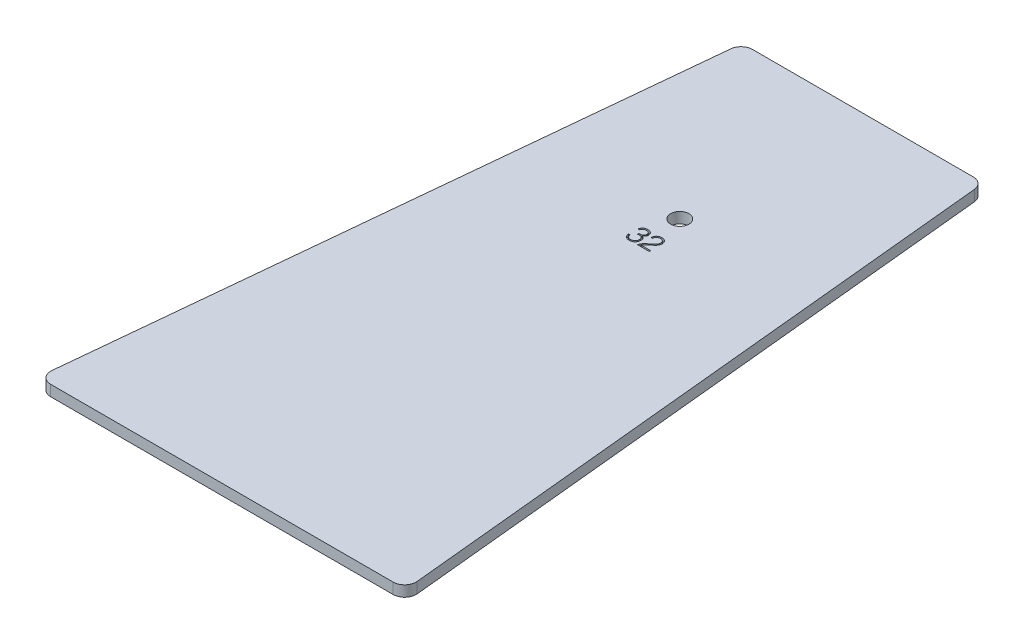
from build123d import *

# Parameters (mm, degrees)
BOSS_EXTRUDE1_DEPTH = 5.9944
SKETCH2_R           = 5.08
CUT_EXTRUDE1_DEPTH  = 370.992656505
CUT_EXTRUDE2_DEPTH  = 1.27
FILLET1_R           = 6.35


with BuildPart() as part:
    # Sketch1 → Boss-Extrude1 (new body)
    with BuildSketch(Plane(origin=(0, 0, 0), x_dir=(1, 0, 0), z_dir=(0, 1, 0))):
        Polygon((-66.9925, 0), (66.9925, 0), (102.016043034, -355.6), (-102.016043034, -355.6), align=None)
    extrude(amount=BOSS_EXTRUDE1_DEPTH)

    # Sketch2 → Cut-Extrude1 (cut, through all)
    with BuildSketch(Plane(origin=(0, 5.9944, 0), x_dir=(1, 0, 0), z_dir=(0, 1, 0))):
        with Locations(Location((0, -101.6, 0), (0, 0, 270))):
            Circle(SKETCH2_R)
    extrude(amount=-CUT_EXTRUDE1_DEPTH, mode=Mode.SUBTRACT)

    # Sketch3 → Cut-Extrude2 (cut)
    with BuildSketch(Plane(origin=(0, 5.9944, 0), x_dir=(1, 0, 0), z_dir=(0, 1, 0))):
        with BuildLine():
            Line((-7.022352941, -123.068602941), (-6.225490196, -122.940980392))
            add(Edge.make_bspline(
                [(-6.225490196, -122.940980392), (-6.179159168, -123.113672862), (-6.090766085, -123.443145791), (-5.893002314, -123.893116495), (-5.653326656, -124.277637163), (-5.362735748, -124.592717125), (-5.023623342, -124.836847536), (-4.639439373, -125.009559122), (-4.210900555, -125.114996328), (-3.91023845, -125.126417063), (-3.753970588, -125.132352941)],
                knots=[0, 0, 0, 0, 1.185952709, 2.262630877, 3.250838064, 4.182033203, 5.090336224, 6.006134824, 6.963696984, 8, 8, 8, 8], degree=3))
            add(Edge.make_bspline(
                [(-3.753970588, -125.132352941), (-3.632311974, -125.129294556), (-3.396778139, -125.123373454), (-3.055537122, -125.062438499), (-2.739613531, -124.962860022), (-2.44676451, -124.825432627), (-2.1842903, -124.650311606), (-1.946018921, -124.449446481), (-1.740349543, -124.216617453), (-1.561552955, -123.957580623), (-1.416849481, -123.67148988), (-1.319432673, -123.358844856), (-1.253270796, -123.026773567), (-1.247865406, -122.79709633), (-1.245098039, -122.679509804)],
                knots=[0, 0, 0, 0, 1.112391676, 2.1536155, 3.159607968, 4.13650094, 5.103002125, 6.039177095, 6.980681787, 7.936725385, 8.913387604, 9.901293339, 10.925537295, 12, 12, 12, 12], degree=3))
            add(Edge.make_bspline(
                [(-1.245098039, -122.679509804), (-1.246477833, -122.600522673), (-1.249194291, -122.445017372), (-1.282695151, -122.219426954), (-1.327451026, -122.004938691), (-1.396057418, -121.803943287), (-1.489048405, -121.617377102), (-1.592290807, -121.437763337), (-1.722685616, -121.275763034), (-1.917485463, -121.076343486), (-2.20188298, -120.864069311), (-2.593312238, -120.677013181), (-3.036743624, -120.571255612), (-3.346678027, -120.557536056), (-3.508063725, -120.550392157)],
                knots=[0, 0, 0, 0, 0.811772018, 1.598169866, 2.341374635, 3.06367051, 3.774921333, 4.483283491, 5.190035732, 5.907028974, 7.347870326, 8.813481259, 10.340750343, 12, 12, 12, 12], degree=3))
            add(Edge.make_bspline(
                [(-3.508063725, -120.550392157), (-3.570458136, -120.553211168), (-3.706544321, -120.55935961), (-3.923959231, -120.600132932), (-4.170366976, -120.662415604), (-4.34159116, -120.719358558), (-4.43254902, -120.749607843)],
                knots=[0, 0, 0, 0, 0.788647944, 1.720091416, 2.788864984, 4, 4, 4, 4], degree=3))
            Line((-4.43254902, -120.749607843), (-4.339166667, -119.952745098))
            add(Edge.make_bspline(
                [(-4.339166667, -119.952745098), (-4.211491436, -119.950936246), (-3.969367573, -119.947505931), (-3.628545312, -119.922817047), (-3.330265399, -119.885264194), (-3.000954361, -119.807625151), (-2.646422183, -119.674933754), (-2.338322284, -119.490885157), (-2.131152352, -119.319361376), (-1.999871604, -119.178734556), (-1.890363345, -119.027511909), (-1.797899612, -118.86789123), (-1.729210893, -118.693480512), (-1.681209143, -118.508345213), (-1.647346728, -118.311468027), (-1.644829413, -118.176557999), (-1.643529412, -118.106887255)],
                knots=[0, 0, 0, 0, 1.451240035, 2.752137916, 3.88312397, 4.8644669, 6.592895175, 8.164668079, 8.918269139, 9.644320432, 10.345018353, 11.037025267, 11.735734825, 12.468177286, 13.208930344, 14, 14, 14, 14], degree=3))
            add(Edge.make_bspline(
                [(-1.643529412, -118.106887255), (-1.650509345, -117.983610579), (-1.66411437, -117.743324277), (-1.776821399, -117.401046126), (-1.96596106, -117.098265223), (-2.224892561, -116.840701279), (-2.536214171, -116.629020004), (-2.893116827, -116.475476622), (-3.290761262, -116.383395594), (-3.568768596, -116.372523158), (-3.713504902, -116.366862745)],
                knots=[0, 0, 0, 0, 0.976737165, 1.903819668, 2.824737209, 3.785549291, 4.781400884, 5.79567262, 6.852382064, 8, 8, 8, 8], degree=3))
            add(Edge.make_bspline(
                [(-3.713504902, -116.366862745), (-3.854039415, -116.371791417), (-4.12537475, -116.381307391), (-4.513600015, -116.467110178), (-4.865095935, -116.607514109), (-5.17833718, -116.807215106), (-5.453425475, -117.062995686), (-5.684159559, -117.378756965), (-5.883219335, -117.745828774), (-5.97729652, -118.018070701), (-6.02627451, -118.159803922)],
                knots=[0, 0, 0, 0, 1.063244, 2.052845668, 2.994088376, 3.916241797, 4.850371738, 5.821675903, 6.865931876, 8, 8, 8, 8], degree=3))
            Line((-6.02627451, -118.159803922), (-6.823137255, -118.007279412))
            add(Edge.make_bspline(
                [(-6.823137255, -118.007279412), (-6.795507069, -117.908263802), (-6.741395917, -117.714350929), (-6.638235475, -117.438000328), (-6.521644051, -117.180742974), (-6.39619017, -116.940453145), (-6.251608562, -116.72101519), (-6.09249965, -116.521665128), (-5.920815848, -116.340294928), (-5.736152715, -116.176736099), (-5.535865927, -116.032888014), (-5.320569348, -115.908978205), (-5.093111316, -115.802051694), (-4.850790057, -115.717919709), (-4.594226042, -115.653756692), (-4.324277726, -115.602706227), (-4.039873378, -115.575380927), (-3.846367498, -115.571816599), (-3.747745098, -115.57)],
                knots=[0, 0, 0, 0, 1.151946065, 2.255979367, 3.302323512, 4.316963809, 5.291200695, 6.243031876, 7.172717729, 8.087440795, 9.004158252, 9.931804679, 10.868449138, 11.817504777, 12.802032331, 13.83090576, 14.894497265, 16, 16, 16, 16], degree=3))
            add(Edge.make_bspline(
                [(-3.747745098, -115.57), (-3.640762164, -115.571134578), (-3.431393848, -115.573354975), (-3.126775673, -115.609879124), (-2.837313267, -115.662151303), (-2.56322677, -115.734994388), (-2.307835885, -115.836020829), (-2.068092886, -115.955485342), (-1.843673392, -116.09447094), (-1.638127063, -116.257539882), (-1.451493202, -116.43696588), (-1.287791849, -116.633237344), (-1.153981272, -116.848271897), (-1.040592711, -117.075951667), (-0.953424076, -117.320547421), (-0.891547543, -117.580392137), (-0.853370675, -117.855698039), (-0.848936049, -118.044506384), (-0.846666667, -118.141127451)],
                knots=[0, 0, 0, 0, 1.17304118, 2.295671334, 3.360722231, 4.399095647, 5.401139445, 6.368437906, 7.334999225, 8.291519651, 9.241514563, 10.171449278, 11.087342197, 12.013926289, 12.957350552, 13.929260155, 14.940316477, 16, 16, 16, 16], degree=3))
            add(Edge.make_bspline(
                [(-0.846666667, -118.141127451), (-0.850930579, -118.256558068), (-0.859217004, -118.480884227), (-0.92146644, -118.80693692), (-1.031917246, -119.107338687), (-1.182879951, -119.386249798), (-1.379156133, -119.63939225), (-1.614751692, -119.87329668), (-1.897947491, -120.078496141), (-2.108008459, -120.192705027), (-2.21627451, -120.251568627)],
                knots=[0, 0, 0, 0, 1.039153621, 2.01947583, 2.9741737, 3.910731788, 4.863782364, 5.848192228, 6.890951849, 8, 8, 8, 8], degree=3))
            add(Edge.make_bspline(
                [(-2.21627451, -120.251568627), (-2.076605097, -120.297135403), (-1.806544353, -120.385242005), (-1.440808729, -120.58262141), (-1.133728819, -120.830069975), (-0.877589438, -121.120636681), (-0.685343201, -121.463379276), (-0.543367347, -121.847361186), (-0.463326152, -122.278848212), (-0.453422318, -122.580608394), (-0.448235294, -122.738651961)],
                knots=[0, 0, 0, 0, 1.062050142, 2.053549488, 2.988468085, 3.904211674, 4.839582746, 5.816291321, 6.856306669, 8, 8, 8, 8], degree=3))
            add(Edge.make_bspline(
                [(-0.448235294, -122.738651961), (-0.451291104, -122.855014514), (-0.457288258, -123.083380833), (-0.502478751, -123.417657966), (-0.571377301, -123.735672586), (-0.676738803, -124.034186175), (-0.807153117, -124.316876649), (-0.969873616, -124.581571508), (-1.160792719, -124.828915505), (-1.379109975, -125.056141259), (-1.620394131, -125.260207248), (-1.881430984, -125.438882746), (-2.157648032, -125.592689762), (-2.454217209, -125.713387607), (-2.766248092, -125.811407575), (-3.097158213, -125.877287666), (-3.444464768, -125.924350599), (-3.682208492, -125.927569671), (-3.80377451, -125.929215686)],
                knots=[0, 0, 0, 0, 1.072071369, 2.103984363, 3.103853144, 4.0655425, 5.015271866, 5.96812527, 6.922560812, 7.8897021, 8.866767387, 9.829597087, 10.801124953, 11.774298562, 12.775446883, 13.810677578, 14.880528982, 16, 16, 16, 16], degree=3))
            add(Edge.make_bspline(
                [(-3.80377451, -125.929215686), (-3.91174159, -125.926380954), (-4.121899618, -125.920863145), (-4.430362418, -125.890720053), (-4.721742092, -125.834404654), (-4.998637664, -125.757502141), (-5.256115535, -125.653715683), (-5.499932286, -125.53163902), (-5.726545074, -125.385760493), (-5.936578214, -125.215939691), (-6.130179855, -125.024934126), (-6.30864799, -124.813174484), (-6.467563012, -124.575955577), (-6.614344715, -124.318893999), (-6.741149501, -124.036717645), (-6.852809332, -123.733950277), (-6.950758779, -123.410032489), (-6.998114815, -123.184193544), (-7.022352941, -123.068602941)],
                knots=[0, 0, 0, 0, 1.092142754, 2.125856941, 3.130178579, 4.090157876, 5.027443808, 5.933183123, 6.844256067, 7.747255784, 8.659958934, 9.591056537, 10.542798976, 11.543715938, 12.581523217, 13.667244669, 14.806031458, 16, 16, 16, 16], degree=3))
        make_face()
        with BuildLine():
            Line((7.121960784, -125.73), (0.747058824, -125.73))
            add(Edge.make_bspline(
                [(0.747058824, -125.73), (0.773711728, -125.56647139), (0.826765394, -125.240961184), (0.946972244, -124.833851847), (1.108426669, -124.502541973), (1.2943472, -124.222842773), (1.533929241, -123.909374898), (1.83620082, -123.565961589), (2.200292405, -123.193461978), (2.63182725, -122.795086731), (3.13028863, -122.372704423), (3.49047647, -122.089977316), (3.679264706, -121.941789216)],
                knots=[0, 0, 0, 0, 1.00794059, 2.006345856, 2.568221262, 3.244176762, 4.045978883, 4.967707078, 6.025786227, 7.214078669, 8.539791974, 10, 10, 10, 10], degree=3))
            add(Edge.make_bspline(
                [(3.679264706, -121.941789216), (3.81017426, -121.839291022), (4.057315869, -121.645786669), (4.40163113, -121.370812364), (4.695891728, -121.12638684), (5.019603916, -120.849934026), (5.36745485, -120.521669006), (5.718952481, -120.119964738), (5.999490533, -119.720001197), (6.19461898, -119.317093709), (6.306715143, -118.90576348), (6.318924697, -118.627391436), (6.325098039, -118.486642157)],
                knots=[0, 0, 0, 0, 1.105083233, 2.086265203, 2.928643677, 3.647492745, 4.915719202, 6.103603942, 7.190110835, 8.152548768, 9.065899631, 10, 10, 10, 10], degree=3))
            add(Edge.make_bspline(
                [(6.325098039, -118.486642157), (6.321446087, -118.383696155), (6.314349268, -118.183641793), (6.261203587, -117.89411156), (6.170514931, -117.626810225), (6.043536736, -117.381877206), (5.889513793, -117.157206868), (5.701809674, -116.959226462), (5.489267579, -116.783379567), (5.248239638, -116.634524628), (4.984825862, -116.511539466), (4.696783261, -116.429562416), (4.390139044, -116.373277743), (4.177576912, -116.369040126), (4.068357843, -116.366862745)],
                knots=[0, 0, 0, 0, 1.066440105, 2.072406788, 3.038089023, 3.980626898, 4.923164774, 5.851240192, 6.79842777, 7.774055624, 8.779619978, 9.800248095, 10.869719403, 12, 12, 12, 12], degree=3))
            add(Edge.make_bspline(
                [(4.068357843, -116.366862745), (3.913138853, -116.372784339), (3.615554949, -116.384137145), (3.193569287, -116.488503349), (2.820686954, -116.662202163), (2.496253078, -116.90555858), (2.228324958, -117.223699711), (2.008875434, -117.605911882), (1.84467465, -118.058408876), (1.778141707, -118.385922919), (1.743137255, -118.558235294)],
                knots=[0, 0, 0, 0, 1.052503955, 2.0178474, 2.928593632, 3.828899676, 4.748107049, 5.732867451, 6.807211463, 8, 8, 8, 8], degree=3))
            Line((1.743137255, -118.558235294), (0.94627451, -118.43372549))
            add(Edge.make_bspline(
                [(0.94627451, -118.43372549), (0.960076615, -118.324490516), (0.987075599, -118.110810556), (1.056468745, -117.80167694), (1.146188383, -117.510865089), (1.259180859, -117.238067127), (1.392180985, -116.983643092), (1.546450374, -116.746154212), (1.724285462, -116.528535029), (1.923282869, -116.329076963), (2.142101916, -116.151961167), (2.375614318, -115.994859502), (2.626947111, -115.86447923), (2.892029837, -115.754431463), (3.173744154, -115.670607699), (3.470725503, -115.611680986), (3.783264758, -115.577611658), (3.996681691, -115.57257374), (4.105710784, -115.57)],
                knots=[0, 0, 0, 0, 1.11558569, 2.182252598, 3.206865404, 4.197163727, 5.171016007, 6.113287932, 7.062752653, 8.014719109, 8.96418383, 9.912249364, 10.862587531, 11.829428462, 12.817713982, 13.836697005, 14.894825442, 16, 16, 16, 16], degree=3))
            add(Edge.make_bspline(
                [(4.105710784, -115.57), (4.212691173, -115.572319789), (4.423171976, -115.576883907), (4.73152187, -115.614942211), (5.025393604, -115.6768103), (5.304114933, -115.763662981), (5.56652099, -115.877884746), (5.818209418, -116.010088278), (6.051929332, -116.17490368), (6.27177244, -116.359297976), (6.46966303, -116.564753592), (6.646765919, -116.782681404), (6.792856103, -117.018893798), (6.916242282, -117.266964655), (7.004716311, -117.53292748), (7.074539512, -117.809240088), (7.11583418, -118.101497133), (7.119889172, -118.30078564), (7.121960784, -118.402598039)],
                knots=[0, 0, 0, 0, 1.106681904, 2.177364475, 3.209175827, 4.210887483, 5.192078542, 6.167200624, 7.147039734, 8.145062256, 9.132109826, 10.094560107, 11.044836899, 12.000375742, 12.954465884, 13.938765234, 14.946957558, 16, 16, 16, 16], degree=3))
            add(Edge.make_bspline(
                [(7.121960784, -118.402598039), (7.118392459, -118.525228757), (7.111338565, -118.767646194), (7.054282598, -119.12624646), (6.955587318, -119.47254261), (6.826036956, -119.810657932), (6.655519429, -120.134164725), (6.45506167, -120.448008584), (6.2217572, -120.749083332), (5.999069689, -120.99003171), (5.795892234, -121.182307301), (5.621380071, -121.345116208), (5.422657341, -121.522181935), (5.198743473, -121.711175794), (4.950765126, -121.913074715), (4.684829881, -122.135434202), (4.391752033, -122.368392422), (4.186857186, -122.526226013), (4.080808824, -122.607916667)],
                knots=[0, 0, 0, 0, 1.088993338, 2.152731221, 3.214950677, 4.282992305, 5.363056107, 6.45734114, 7.587448717, 8.741912054, 9.367708333, 10.072059012, 10.861970471, 11.731730561, 12.674646287, 13.702521352, 14.810883478, 16, 16, 16, 16], degree=3))
            add(Edge.make_bspline(
                [(4.080808824, -122.607916667), (3.954531577, -122.707673071), (3.708139397, -122.90231778), (3.359847151, -123.201952264), (3.038432745, -123.495186281), (2.751447313, -123.789920338), (2.492000006, -124.07905832), (2.262403274, -124.36473001), (2.058792631, -124.64507084), (1.947015901, -124.838757211), (1.89254902, -124.933137255)],
                knots=[0, 0, 0, 0, 1.201760701, 2.344875646, 3.430713183, 4.449969728, 5.415927222, 6.330865599, 7.186659457, 8, 8, 8, 8], degree=3))
            Line((1.89254902, -124.933137255), (7.121960784, -124.933137255))
            Line((7.121960784, -124.933137255), (7.121960784, -125.73))
        make_face()
    extrude(amount=-CUT_EXTRUDE2_DEPTH, mode=Mode.SUBTRACT)

    # Fillet1
    fillet1_edges = [part.edges().sort_by_distance(p)[0] for p in [
        (102.016043034, 2.9972, 355.6),
        (-102.016043034, 2.9972, 355.6),
        (-66.9925, 2.9972, 0),
        (66.9925, 2.9972, 0),
    ]]
    fillet(fillet1_edges, radius=FILLET1_R)


solid = part.part
